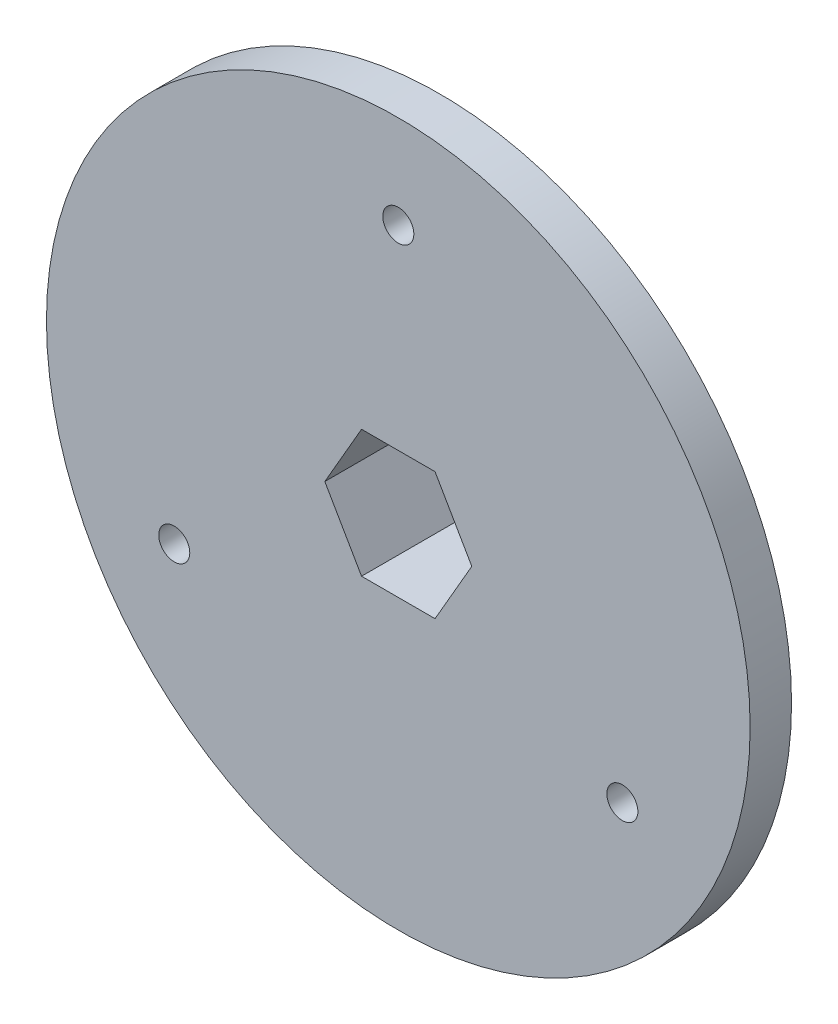
from build123d import *

# Parameters (mm, degrees)
CROQUIS1_R              = 34
CROQUIS1_R_2            = 1.5
SALIENTE_EXTRUIR1_DEPTH = 4
CORTAR_EXTRUIR1_DEPTH   = 4
SALIENTE_EXTRUIR2_START = 6
CROQUIS3_R              = 9
CROQUIS3_R_2            = 1.5
SALIENTE_EXTRUIR2_DEPTH = 6


with BuildPart() as part:
    # Croquis1 → Saliente-Extruir1 (new body)
    with BuildSketch(Plane.XY):
        Circle(CROQUIS1_R)
        with Locations((0, 25)):
            Circle(CROQUIS1_R_2, mode=Mode.SUBTRACT)
        with Locations((21.650635095, -12.5)):
            Circle(CROQUIS1_R_2, mode=Mode.SUBTRACT)
        with Locations((-21.650635095, -12.5)):
            Circle(CROQUIS1_R_2, mode=Mode.SUBTRACT)
    extrude(amount=SALIENTE_EXTRUIR1_DEPTH)

    # Croquis2 → Cortar-Extruir1 (cut)
    with BuildSketch(Plane(origin=(0, 0, 0), x_dir=(-1, 0, 0), z_dir=(0, 0, -1))):
        Polygon((3.550704156, 6.15), (-3.550704156, 6.15), (-7.101408311, 0), (-3.550704156, -6.15), (3.550704156, -6.15), (7.101408311, 0), align=None)
    extrude(amount=-CORTAR_EXTRUIR1_DEPTH, mode=Mode.SUBTRACT)

    # Croquis3 → Saliente-Extruir2 (add)
    # profile 1 of 4: a face of its own
    with BuildSketch(Plane(origin=(0, 0, 0), x_dir=(-1, 0, 0), z_dir=(0, 0, -1)).offset(SALIENTE_EXTRUIR2_START)):
        with Locations(Location((0, 0, 0), (0, 0, 180))):
            Circle(CROQUIS3_R)
        Polygon((-7.101408311, 0), (-3.550704156, 6.15), (3.550704156, 6.15), (7.101408311, 0), (3.550704156, -6.15), (-3.550704156, -6.15), align=None, mode=Mode.SUBTRACT)
    # profile 2 of 4: a face of its own
    with BuildSketch(Plane(origin=(0, 0, 0), x_dir=(-1, 0, 0), z_dir=(0, 0, -1)).offset(SALIENTE_EXTRUIR2_START)):
        with Locations(Location((0, 25, 0), (0, 0, 180))):
            Circle(CROQUIS3_R_2)
    # profile 3 of 4: a face of its own
    with BuildSketch(Plane(origin=(0, 0, 0), x_dir=(-1, 0, 0), z_dir=(0, 0, -1)).offset(SALIENTE_EXTRUIR2_START)):
        with Locations(Location((-21.650635095, -12.5, 0), (0, 0, 180))):
            Circle(CROQUIS3_R_2)
    # profile 4 of 4: a face of its own
    with BuildSketch(Plane(origin=(0, 0, 0), x_dir=(-1, 0, 0), z_dir=(0, 0, -1)).offset(SALIENTE_EXTRUIR2_START)):
        with Locations(Location((21.650635095, -12.5, 0), (0, 0, 180))):
            Circle(CROQUIS3_R_2)
    extrude(amount=-SALIENTE_EXTRUIR2_DEPTH)


with BuildPart() as saliente_extruir2_kept_piece:
    # of the separate pieces the step leaves, the one the design keeps (saliente_extruir2_pieces_kept)
    add(part.part.solids().sort_by_distance((34, 0, 0))[0])

    # Croquis4 → Revolución1 (revolve)
    with BuildSketch(Plane(origin=(0, 0, 0), x_dir=(1, 0, 0), z_dir=(0, 1, 0))):
        Polygon((9, 6), (9, 0), (16.96226893, 0), align=None)
    revolve(axis=Axis((0, 0, -12.759887465), (0, 0, 1)))


solid = saliente_extruir2_kept_piece.part
